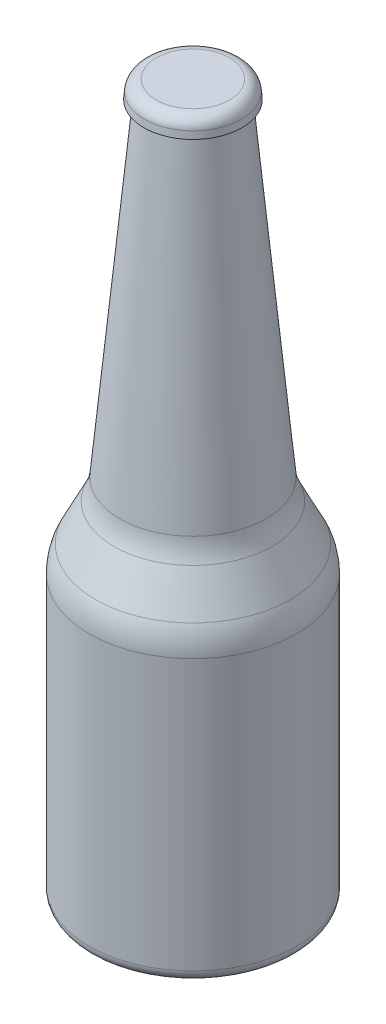
from build123d import *

# Parameters (mm, degrees)
FILLET1_R = 0.1
FILLET2_R = 0.02


with BuildPart() as part:
    # Sketch1 → Revolve1 (revolve)
    with BuildSketch(Plane.XY, mode=Mode.PRIVATE) as revolve1_sk:
        Polygon((0, 0), (-0.175, 0), (-0.175, 0.5), (-0.125, 0.6), (-0.072, 1.168994536), (-0.082794403, 1.17), (-0.08, 1.2), (0, 1.2), align=None)
    revolve(revolve1_sk.sketch.rotate(Axis((0, 0, 0), (0, 1, 0)), 270), axis=Axis((0, 0, 0), (0, 1, 0)))

    # Fillet1
    fillet1_edges = [part.edges().sort_by_distance(p)[0] for p in [
        (0, 0.6, 0.125),
        (0, 0.5, 0.175),
    ]]
    fillet(fillet1_edges, radius=FILLET1_R)

    # Fillet2
    fillet2_edges = [part.edges().sort_by_distance(p)[0] for p in [
        (0, 1.2, 0.08),
        (0, 0, 0.175),
    ]]
    fillet(fillet2_edges, radius=FILLET2_R)


solid = part.part
